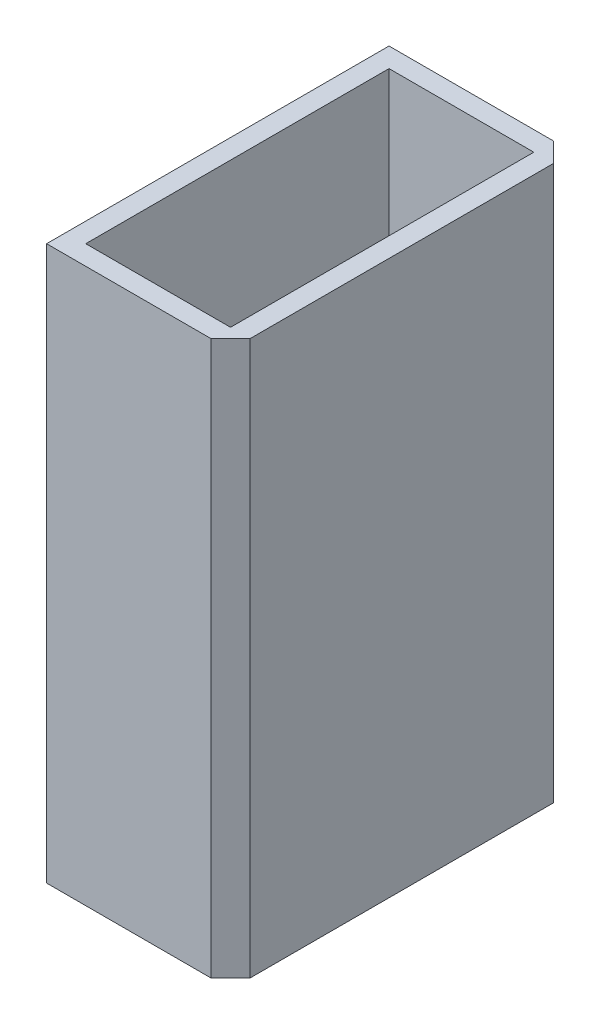
from build123d import *

# Parameters (mm, degrees)
SKETCH1_W           = 23.876
SKETCH1_H           = 44.45
SKETCH1_W_2         = 18.796
SKETCH1_H_2         = 39.37
BOSS_EXTRUDE1_DEPTH = 69.342
SKETCH2_W           = 23.876
SKETCH2_H           = 44.45
BOSS_EXTRUDE2_DEPTH = 2.54
CHAMFER1_SIZE       = 2.54


with BuildPart() as part:
    # Sketch1 → Boss-Extrude1 (new body)
    with BuildSketch(Plane(origin=(0, 0, 0), x_dir=(1, 0, 0), z_dir=(0, 1, 0))):
        with Locations((9.398, 19.685)):
            Rectangle(SKETCH1_W, SKETCH1_H)
        with Locations((9.398, 19.685)):
            Rectangle(SKETCH1_W_2, SKETCH1_H_2, mode=Mode.SUBTRACT)
    extrude(amount=BOSS_EXTRUDE1_DEPTH)

    # Sketch2 → Boss-Extrude2 (add)
    with BuildSketch(Plane.XZ):
        with Locations((9.398, -19.685)):
            Rectangle(SKETCH2_W, SKETCH2_H)
    extrude(amount=BOSS_EXTRUDE2_DEPTH)

    # Chamfer1
    chamfer1_edges = [part.edges().sort_by_distance(p)[0] for p in [
        (21.336, 33.401, -41.91),
        (21.336, 33.401, 2.54),
    ]]
    chamfer(chamfer1_edges, length=CHAMFER1_SIZE)


solid = part.part
